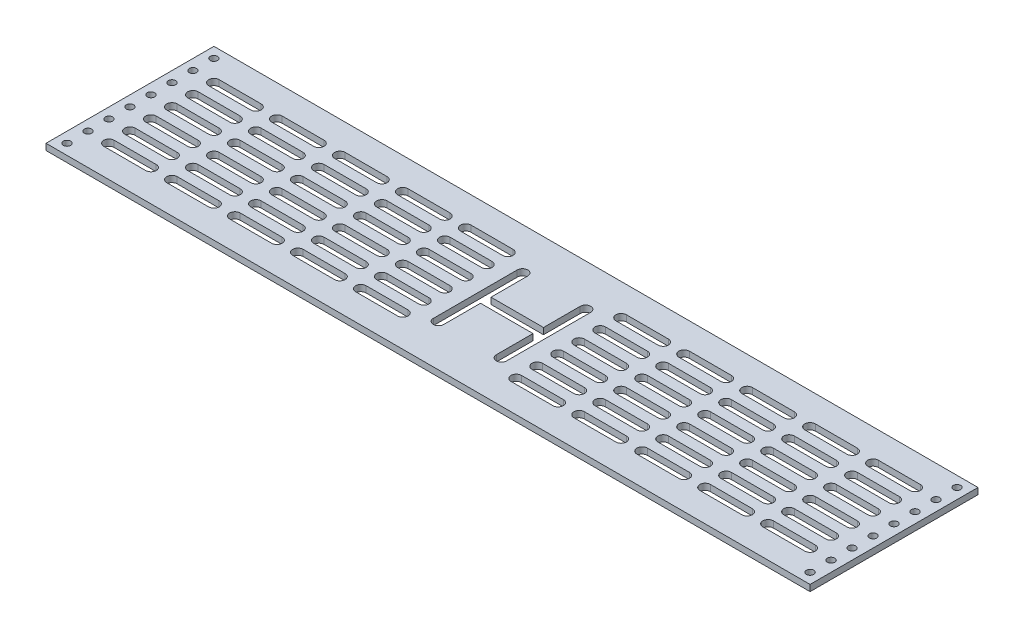
from build123d import *

# Parameters (mm, degrees)
EXTRUDE_1_DEPTH     = 3
SKETCH_2_R          = 1.75
CUT_EXTRUDE_1_DEPTH = 199.829072321
CUT_EXTRUDE_2_DEPTH = 199.829072321


with BuildPart() as part:
    # 草图1 → 凸台-拉伸1 (new body)
    with BuildSketch(Plane(origin=(0, 0, 0), x_dir=(1, 0, 0), z_dir=(0, 1, 0))):
        Polygon((0, 0), (-182, 0), (-182, -80), (182, -80), (182, 0), align=None)
    extrude(amount=EXTRUDE_1_DEPTH)

    # 草图2 → 切除-拉伸1 (cut, through all)
    with BuildSketch(Plane(origin=(0, 3, 0), x_dir=(1, 0, 0), z_dir=(0, 1, 0))):
        with BuildLine():
            ThreePointArc((-177, -73.25), (-178.75, -75), (-177, -76.75))
            Line((-177, -76.75), (-177, -75))
            Line((-177, -75), (-177, -73.25))
        make_face()
        with BuildLine():
            Line((-177, -75), (-177, -76.75))
            ThreePointArc((-177, -76.75), (-175.762563133, -76.237436867), (-175.25, -75))
            ThreePointArc((-175.25, -75), (-175.762563133, -73.762563133), (-177, -73.25))
            Line((-177, -73.25), (-177, -75))
        make_face()
        with BuildLine():
            ThreePointArc((-177, -63.25), (-178.75, -65), (-177, -66.75))
            Line((-177, -66.75), (-177, -63.25))
        make_face()
        with BuildLine():
            Line((-177, -63.25), (-177, -66.75))
            ThreePointArc((-177, -66.75), (-175.762563133, -66.237436867), (-175.25, -65))
            ThreePointArc((-175.25, -65), (-175.762563133, -63.762563133), (-177, -63.25))
        make_face()
        with BuildLine():
            ThreePointArc((-177, -53.25), (-178.75, -55), (-177, -56.75))
            Line((-177, -56.75), (-177, -53.25))
        make_face()
        with BuildLine():
            Line((-177, -53.25), (-177, -56.75))
            ThreePointArc((-177, -56.75), (-175.762563133, -56.237436867), (-175.25, -55))
            ThreePointArc((-175.25, -55), (-175.762563133, -53.762563133), (-177, -53.25))
        make_face()
        with BuildLine():
            ThreePointArc((-177, -43.25), (-178.75, -45), (-177, -46.75))
            Line((-177, -46.75), (-177, -43.25))
        make_face()
        with BuildLine():
            Line((-177, -43.25), (-177, -46.75))
            ThreePointArc((-177, -46.75), (-175.762563133, -46.237436867), (-175.25, -45))
            ThreePointArc((-175.25, -45), (-175.762563133, -43.762563133), (-177, -43.25))
        make_face()
        with BuildLine():
            ThreePointArc((-177, -33.25), (-178.75, -35), (-177, -36.75))
            Line((-177, -36.75), (-177, -33.25))
        make_face()
        with BuildLine():
            Line((-177, -33.25), (-177, -36.75))
            ThreePointArc((-177, -36.75), (-175.762563133, -36.237436867), (-175.25, -35))
            ThreePointArc((-175.25, -35), (-175.762563133, -33.762563133), (-177, -33.25))
        make_face()
        with BuildLine():
            ThreePointArc((-177, -23.25), (-178.75, -25), (-177, -26.75))
            Line((-177, -26.75), (-177, -23.25))
        make_face()
        with BuildLine():
            Line((-177, -23.25), (-177, -26.75))
            ThreePointArc((-177, -26.75), (-175.762563133, -26.237436867), (-175.25, -25))
            ThreePointArc((-175.25, -25), (-175.762563133, -23.762563133), (-177, -23.25))
        make_face()
        with BuildLine():
            ThreePointArc((-177, -13.25), (-178.75, -15), (-177, -16.75))
            Line((-177, -16.75), (-177, -13.25))
        make_face()
        with BuildLine():
            Line((-177, -13.25), (-177, -16.75))
            ThreePointArc((-177, -16.75), (-175.762563133, -16.237436867), (-175.25, -15))
            ThreePointArc((-175.25, -15), (-175.762563133, -13.762563133), (-177, -13.25))
        make_face()
        with BuildLine():
            ThreePointArc((-177, -3.25), (-178.75, -5), (-177, -6.75))
            Line((-177, -6.75), (-177, -3.25))
        make_face()
        with BuildLine():
            Line((-177, -3.25), (-177, -6.75))
            ThreePointArc((-177, -6.75), (-175.762563133, -6.237436867), (-175.25, -5))
            ThreePointArc((-175.25, -5), (-175.762563133, -3.762563133), (-177, -3.25))
        make_face()
        with Locations(Location((177, -5, 0), (0, 0, 270))):
            Circle(SKETCH_2_R)
        with Locations(Location((177, -15, 0), (0, 0, 270))):
            Circle(SKETCH_2_R)
        with Locations(Location((177, -25, 0), (0, 0, 270))):
            Circle(SKETCH_2_R)
        with Locations(Location((177, -35, 0), (0, 0, 270))):
            Circle(SKETCH_2_R)
        with Locations(Location((177, -45, 0), (0, 0, 270))):
            Circle(SKETCH_2_R)
        with Locations(Location((177, -55, 0), (0, 0, 270))):
            Circle(SKETCH_2_R)
        with Locations(Location((177, -65, 0), (0, 0, 270))):
            Circle(SKETCH_2_R)
        with Locations(Location((177, -75, 0), (0, 0, 270))):
            Circle(SKETCH_2_R)
    extrude(amount=-CUT_EXTRUDE_1_DEPTH, mode=Mode.SUBTRACT)

    # 草图3 → 切除-拉伸2 (cut, through all)
    with BuildSketch(Plane(origin=(0, 3, 0), x_dir=(1, 0, 0), z_dir=(0, 1, 0))):
        with BuildLine():
            Line((12.5, -37.5), (-12.5, -37.5))
            Line((-12.5, -37.5), (-12.5, -20))
            ThreePointArc((-12.5, -20), (-15, -17.5), (-17.5, -20))
            Line((-17.5, -20), (-17.5, -60))
            ThreePointArc((-17.5, -60), (-15, -62.5), (-12.5, -60))
            Line((-12.5, -60), (-12.5, -42.5))
            Line((-12.5, -42.5), (12.5, -42.5))
            Line((12.5, -42.5), (12.5, -60))
            ThreePointArc((12.5, -60), (15, -62.5), (17.5, -60))
            Line((17.5, -60), (17.5, -20))
            ThreePointArc((17.5, -20), (15, -17.5), (12.5, -20))
            Line((12.5, -20), (12.5, -37.5))
        make_face()
        with BuildLine():
            ThreePointArc((-147, -67.5), (-144.5, -65), (-147, -62.5))
            Line((-147, -62.5), (-167, -62.5))
            ThreePointArc((-167, -62.5), (-169.5, -65), (-167, -67.5))
            Line((-167, -67.5), (-147, -67.5))
        make_face()
        with BuildLine():
            ThreePointArc((-117, -67.5), (-114.5, -65), (-117, -62.5))
            Line((-117, -62.5), (-137, -62.5))
            ThreePointArc((-137, -62.5), (-139.5, -65), (-137, -67.5))
            Line((-137, -67.5), (-117, -67.5))
        make_face()
        with BuildLine():
            Line((-107, -17.5), (-87, -17.5))
            ThreePointArc((-87, -17.5), (-84.5, -15), (-87, -12.5))
            Line((-87, -12.5), (-107, -12.5))
            ThreePointArc((-107, -12.5), (-109.5, -15), (-107, -17.5))
        make_face()
        with BuildLine():
            Line((-107, -27.5), (-87, -27.5))
            ThreePointArc((-87, -27.5), (-84.5, -25), (-87, -22.5))
            Line((-87, -22.5), (-107, -22.5))
            ThreePointArc((-107, -22.5), (-109.5, -25), (-107, -27.5))
        make_face()
        with BuildLine():
            Line((-107, -37.5), (-87, -37.5))
            ThreePointArc((-87, -37.5), (-84.5, -35), (-87, -32.5))
            Line((-87, -32.5), (-107, -32.5))
            ThreePointArc((-107, -32.5), (-109.5, -35), (-107, -37.5))
        make_face()
        with BuildLine():
            Line((-107, -47.5), (-87, -47.5))
            ThreePointArc((-87, -47.5), (-84.5, -45), (-87, -42.5))
            Line((-87, -42.5), (-107, -42.5))
            ThreePointArc((-107, -42.5), (-109.5, -45), (-107, -47.5))
        make_face()
        with BuildLine():
            Line((-107, -57.5), (-87, -57.5))
            ThreePointArc((-87, -57.5), (-84.5, -55), (-87, -52.5))
            Line((-87, -52.5), (-107, -52.5))
            ThreePointArc((-107, -52.5), (-109.5, -55), (-107, -57.5))
        make_face()
        with BuildLine():
            ThreePointArc((-47, -62.5), (-48.767766953, -63.232233047), (-49.5, -65))
            ThreePointArc((-49.5, -65), (-48.767766953, -66.767766953), (-47, -67.5))
            Line((-47, -67.5), (-27, -67.5))
            ThreePointArc((-27, -67.5), (-24.5, -65), (-27, -62.5))
            Line((-27, -62.5), (-47, -62.5))
        make_face()
        with BuildLine():
            ThreePointArc((-77, -62.5), (-79.5, -65), (-77, -67.5))
            Line((-77, -67.5), (-57, -67.5))
            ThreePointArc((-57, -67.5), (-54.5, -65), (-57, -62.5))
            Line((-57, -62.5), (-77, -62.5))
        make_face()
        with BuildLine():
            Line((-107, -67.5), (-87, -67.5))
            ThreePointArc((-87, -67.5), (-84.5, -65), (-87, -62.5))
            Line((-87, -62.5), (-107, -62.5))
            ThreePointArc((-107, -62.5), (-109.5, -65), (-107, -67.5))
        make_face()
        with BuildLine():
            ThreePointArc((-167, -52.5), (-169.5, -55), (-167, -57.5))
            Line((-167, -57.5), (-147, -57.5))
            ThreePointArc((-147, -57.5), (-144.5, -55), (-147, -52.5))
            Line((-147, -52.5), (-167, -52.5))
        make_face()
        with BuildLine():
            ThreePointArc((-137, -52.5), (-139.5, -55), (-137, -57.5))
            Line((-137, -57.5), (-117, -57.5))
            ThreePointArc((-117, -57.5), (-114.5, -55), (-117, -52.5))
            Line((-117, -52.5), (-137, -52.5))
        make_face()
        with BuildLine():
            ThreePointArc((-77, -52.5), (-79.5, -55), (-77, -57.5))
            Line((-77, -57.5), (-57, -57.5))
            ThreePointArc((-57, -57.5), (-54.5, -55), (-57, -52.5))
            Line((-57, -52.5), (-77, -52.5))
        make_face()
        with BuildLine():
            ThreePointArc((-167, -42.5), (-169.5, -45), (-167, -47.5))
            Line((-167, -47.5), (-147, -47.5))
            ThreePointArc((-147, -47.5), (-144.5, -45), (-147, -42.5))
            Line((-147, -42.5), (-167, -42.5))
        make_face()
        with BuildLine():
            ThreePointArc((-137, -42.5), (-139.5, -45), (-137, -47.5))
            Line((-137, -47.5), (-117, -47.5))
            ThreePointArc((-117, -47.5), (-114.5, -45), (-117, -42.5))
            Line((-117, -42.5), (-137, -42.5))
        make_face()
        with BuildLine():
            ThreePointArc((-77, -42.5), (-79.5, -45), (-77, -47.5))
            Line((-77, -47.5), (-57, -47.5))
            ThreePointArc((-57, -47.5), (-54.5, -45), (-57, -42.5))
            Line((-57, -42.5), (-77, -42.5))
        make_face()
        with BuildLine():
            ThreePointArc((-167, -32.5), (-169.5, -35), (-167, -37.5))
            Line((-167, -37.5), (-147, -37.5))
            ThreePointArc((-147, -37.5), (-144.5, -35), (-147, -32.5))
            Line((-147, -32.5), (-167, -32.5))
        make_face()
        with BuildLine():
            ThreePointArc((-137, -32.5), (-139.5, -35), (-137, -37.5))
            Line((-137, -37.5), (-117, -37.5))
            ThreePointArc((-117, -37.5), (-114.5, -35), (-117, -32.5))
            Line((-117, -32.5), (-137, -32.5))
        make_face()
        with BuildLine():
            ThreePointArc((-77, -32.5), (-79.5, -35), (-77, -37.5))
            Line((-77, -37.5), (-57, -37.5))
            ThreePointArc((-57, -37.5), (-54.5, -35), (-57, -32.5))
            Line((-57, -32.5), (-77, -32.5))
        make_face()
        with BuildLine():
            ThreePointArc((-167, -22.5), (-169.5, -25), (-167, -27.5))
            Line((-167, -27.5), (-147, -27.5))
            ThreePointArc((-147, -27.5), (-144.5, -25), (-147, -22.5))
            Line((-147, -22.5), (-167, -22.5))
        make_face()
        with BuildLine():
            ThreePointArc((-137, -22.5), (-139.5, -25), (-137, -27.5))
            Line((-137, -27.5), (-117, -27.5))
            ThreePointArc((-117, -27.5), (-114.5, -25), (-117, -22.5))
            Line((-117, -22.5), (-137, -22.5))
        make_face()
        with BuildLine():
            ThreePointArc((-77, -22.5), (-79.5, -25), (-77, -27.5))
            Line((-77, -27.5), (-57, -27.5))
            ThreePointArc((-57, -27.5), (-54.5, -25), (-57, -22.5))
            Line((-57, -22.5), (-77, -22.5))
        make_face()
        with BuildLine():
            ThreePointArc((-167, -12.5), (-169.5, -15), (-167, -17.5))
            Line((-167, -17.5), (-147, -17.5))
            ThreePointArc((-147, -17.5), (-144.5, -15), (-147, -12.5))
            Line((-147, -12.5), (-167, -12.5))
        make_face()
        with BuildLine():
            ThreePointArc((-137, -12.5), (-139.5, -15), (-137, -17.5))
            Line((-137, -17.5), (-117, -17.5))
            ThreePointArc((-117, -17.5), (-114.5, -15), (-117, -12.5))
            Line((-117, -12.5), (-137, -12.5))
        make_face()
        with BuildLine():
            ThreePointArc((-77, -12.5), (-79.5, -15), (-77, -17.5))
            Line((-77, -17.5), (-57, -17.5))
            ThreePointArc((-57, -17.5), (-54.5, -15), (-57, -12.5))
            Line((-57, -12.5), (-77, -12.5))
        make_face()
        with BuildLine():
            Line((87, -67.5), (107, -67.5))
            ThreePointArc((107, -67.5), (109.5, -65), (107, -62.5))
            Line((107, -62.5), (87, -62.5))
            ThreePointArc((87, -62.5), (84.5, -65), (87, -67.5))
        make_face()
        with BuildLine():
            ThreePointArc((77, -67.5), (78.767766953, -66.767766953), (79.5, -65))
            ThreePointArc((79.5, -65), (78.767766953, -63.232233047), (77, -62.5))
            Line((77, -62.5), (57, -62.5))
            ThreePointArc((57, -62.5), (54.5, -65), (57, -67.5))
            Line((57, -67.5), (77, -67.5))
        make_face()
        with BuildLine():
            ThreePointArc((147, -62.5), (145.232233047, -63.232233047), (144.5, -65))
            ThreePointArc((144.5, -65), (145.232233047, -66.767766953), (147, -67.5))
            Line((147, -67.5), (167, -67.5))
            ThreePointArc((167, -67.5), (169.5, -65), (167, -62.5))
            Line((167, -62.5), (147, -62.5))
        make_face()
        with BuildLine():
            ThreePointArc((117, -62.5), (114.5, -65), (117, -67.5))
            Line((117, -67.5), (137, -67.5))
            ThreePointArc((137, -67.5), (139.5, -65), (137, -62.5))
            Line((137, -62.5), (117, -62.5))
        make_face()
        with BuildLine():
            ThreePointArc((77, -17.5), (79.5, -15), (77, -12.5))
            Line((77, -12.5), (57, -12.5))
            ThreePointArc((57, -12.5), (54.5, -15), (57, -17.5))
            Line((57, -17.5), (77, -17.5))
        make_face()
        with BuildLine():
            ThreePointArc((107, -17.5), (109.5, -15), (107, -12.5))
            Line((107, -12.5), (87, -12.5))
            ThreePointArc((87, -12.5), (84.5, -15), (87, -17.5))
            Line((87, -17.5), (107, -17.5))
        make_face()
        with BuildLine():
            ThreePointArc((137, -17.5), (139.5, -15), (137, -12.5))
            Line((137, -12.5), (117, -12.5))
            ThreePointArc((117, -12.5), (114.5, -15), (117, -17.5))
            Line((117, -17.5), (137, -17.5))
        make_face()
        with BuildLine():
            ThreePointArc((77, -27.5), (79.5, -25), (77, -22.5))
            Line((77, -22.5), (57, -22.5))
            ThreePointArc((57, -22.5), (54.5, -25), (57, -27.5))
            Line((57, -27.5), (77, -27.5))
        make_face()
        with BuildLine():
            ThreePointArc((107, -27.5), (109.5, -25), (107, -22.5))
            Line((107, -22.5), (87, -22.5))
            ThreePointArc((87, -22.5), (84.5, -25), (87, -27.5))
            Line((87, -27.5), (107, -27.5))
        make_face()
        with BuildLine():
            ThreePointArc((137, -27.5), (139.5, -25), (137, -22.5))
            Line((137, -22.5), (117, -22.5))
            ThreePointArc((117, -22.5), (114.5, -25), (117, -27.5))
            Line((117, -27.5), (137, -27.5))
        make_face()
        with BuildLine():
            ThreePointArc((77, -37.5), (79.5, -35), (77, -32.5))
            Line((77, -32.5), (57, -32.5))
            ThreePointArc((57, -32.5), (54.5, -35), (57, -37.5))
            Line((57, -37.5), (77, -37.5))
        make_face()
        with BuildLine():
            ThreePointArc((107, -37.5), (109.5, -35), (107, -32.5))
            Line((107, -32.5), (87, -32.5))
            ThreePointArc((87, -32.5), (84.5, -35), (87, -37.5))
            Line((87, -37.5), (107, -37.5))
        make_face()
        with BuildLine():
            ThreePointArc((137, -37.5), (139.5, -35), (137, -32.5))
            Line((137, -32.5), (117, -32.5))
            ThreePointArc((117, -32.5), (114.5, -35), (117, -37.5))
            Line((117, -37.5), (137, -37.5))
        make_face()
        with BuildLine():
            ThreePointArc((167, -37.5), (169.5, -35), (167, -32.5))
            Line((167, -32.5), (147, -32.5))
            ThreePointArc((147, -32.5), (144.5, -35), (147, -37.5))
            Line((147, -37.5), (167, -37.5))
        make_face()
        with BuildLine():
            ThreePointArc((77, -47.5), (79.5, -45), (77, -42.5))
            Line((77, -42.5), (57, -42.5))
            ThreePointArc((57, -42.5), (54.5, -45), (57, -47.5))
            Line((57, -47.5), (77, -47.5))
        make_face()
        with BuildLine():
            ThreePointArc((107, -47.5), (109.5, -45), (107, -42.5))
            Line((107, -42.5), (87, -42.5))
            ThreePointArc((87, -42.5), (84.5, -45), (87, -47.5))
            Line((87, -47.5), (107, -47.5))
        make_face()
        with BuildLine():
            ThreePointArc((137, -47.5), (139.5, -45), (137, -42.5))
            Line((137, -42.5), (117, -42.5))
            ThreePointArc((117, -42.5), (114.5, -45), (117, -47.5))
            Line((117, -47.5), (137, -47.5))
        make_face()
        with BuildLine():
            ThreePointArc((167, -47.5), (169.5, -45), (167, -42.5))
            Line((167, -42.5), (147, -42.5))
            ThreePointArc((147, -42.5), (144.5, -45), (147, -47.5))
            Line((147, -47.5), (167, -47.5))
        make_face()
        with BuildLine():
            ThreePointArc((77, -57.5), (79.5, -55), (77, -52.5))
            Line((77, -52.5), (57, -52.5))
            ThreePointArc((57, -52.5), (54.5, -55), (57, -57.5))
            Line((57, -57.5), (77, -57.5))
        make_face()
        with BuildLine():
            ThreePointArc((107, -57.5), (109.5, -55), (107, -52.5))
            Line((107, -52.5), (87, -52.5))
            ThreePointArc((87, -52.5), (84.5, -55), (87, -57.5))
            Line((87, -57.5), (107, -57.5))
        make_face()
        with BuildLine():
            ThreePointArc((137, -57.5), (139.5, -55), (137, -52.5))
            Line((137, -52.5), (117, -52.5))
            ThreePointArc((117, -52.5), (114.5, -55), (117, -57.5))
            Line((117, -57.5), (137, -57.5))
        make_face()
        with BuildLine():
            ThreePointArc((167, -57.5), (169.5, -55), (167, -52.5))
            Line((167, -52.5), (147, -52.5))
            ThreePointArc((147, -52.5), (144.5, -55), (147, -57.5))
            Line((147, -57.5), (167, -57.5))
        make_face()
        with BuildLine():
            ThreePointArc((167, -27.5), (169.5, -25), (167, -22.5))
            Line((167, -22.5), (147, -22.5))
            ThreePointArc((147, -22.5), (144.5, -25), (147, -27.5))
            Line((147, -27.5), (167, -27.5))
        make_face()
        with BuildLine():
            ThreePointArc((167, -17.5), (169.5, -15), (167, -12.5))
            Line((167, -12.5), (147, -12.5))
            ThreePointArc((147, -12.5), (144.5, -15), (147, -17.5))
            Line((147, -17.5), (167, -17.5))
        make_face()
        with BuildLine():
            ThreePointArc((-47, -52.5), (-49.5, -55), (-47, -57.5))
            Line((-47, -57.5), (-27, -57.5))
            ThreePointArc((-27, -57.5), (-24.5, -55), (-27, -52.5))
            Line((-27, -52.5), (-47, -52.5))
        make_face()
        with BuildLine():
            ThreePointArc((-47, -42.5), (-49.5, -45), (-47, -47.5))
            Line((-47, -47.5), (-27, -47.5))
            ThreePointArc((-27, -47.5), (-24.5, -45), (-27, -42.5))
            Line((-27, -42.5), (-47, -42.5))
        make_face()
        with BuildLine():
            ThreePointArc((-47, -32.5), (-49.5, -35), (-47, -37.5))
            Line((-47, -37.5), (-27, -37.5))
            ThreePointArc((-27, -37.5), (-24.5, -35), (-27, -32.5))
            Line((-27, -32.5), (-47, -32.5))
        make_face()
        with BuildLine():
            ThreePointArc((-47, -22.5), (-49.5, -25), (-47, -27.5))
            Line((-47, -27.5), (-27, -27.5))
            ThreePointArc((-27, -27.5), (-24.5, -25), (-27, -22.5))
            Line((-27, -22.5), (-47, -22.5))
        make_face()
        with BuildLine():
            ThreePointArc((-47, -12.5), (-49.5, -15), (-47, -17.5))
            Line((-47, -17.5), (-27, -17.5))
            ThreePointArc((-27, -17.5), (-24.5, -15), (-27, -12.5))
            Line((-27, -12.5), (-47, -12.5))
        make_face()
        with BuildLine():
            ThreePointArc((47, -17.5), (49.5, -15), (47, -12.5))
            Line((47, -12.5), (27, -12.5))
            ThreePointArc((27, -12.5), (24.5, -15), (27, -17.5))
            Line((27, -17.5), (47, -17.5))
        make_face()
        with BuildLine():
            ThreePointArc((47, -27.5), (49.5, -25), (47, -22.5))
            Line((47, -22.5), (27, -22.5))
            ThreePointArc((27, -22.5), (24.5, -25), (27, -27.5))
            Line((27, -27.5), (47, -27.5))
        make_face()
        with BuildLine():
            ThreePointArc((47, -37.5), (49.5, -35), (47, -32.5))
            Line((47, -32.5), (27, -32.5))
            ThreePointArc((27, -32.5), (24.5, -35), (27, -37.5))
            Line((27, -37.5), (47, -37.5))
        make_face()
        with BuildLine():
            ThreePointArc((47, -47.5), (49.5, -45), (47, -42.5))
            Line((47, -42.5), (27, -42.5))
            ThreePointArc((27, -42.5), (24.5, -45), (27, -47.5))
            Line((27, -47.5), (47, -47.5))
        make_face()
        with BuildLine():
            ThreePointArc((47, -57.5), (49.5, -55), (47, -52.5))
            Line((47, -52.5), (27, -52.5))
            ThreePointArc((27, -52.5), (24.5, -55), (27, -57.5))
            Line((27, -57.5), (47, -57.5))
        make_face()
        with BuildLine():
            ThreePointArc((47, -67.5), (49.5, -65), (47, -62.5))
            Line((47, -62.5), (27, -62.5))
            ThreePointArc((27, -62.5), (24.5, -65), (27, -67.5))
            Line((27, -67.5), (47, -67.5))
        make_face()
    extrude(amount=-CUT_EXTRUDE_2_DEPTH, mode=Mode.SUBTRACT)


solid = part.part
